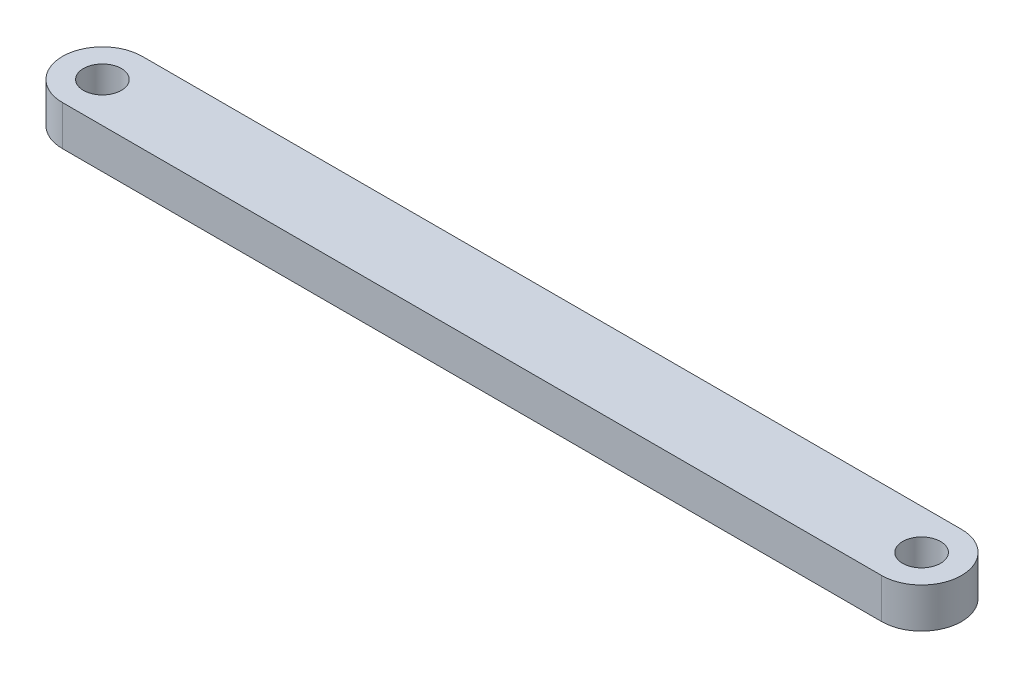
from build123d import *

# Parameters (mm, degrees)
SKETCH2_R           = 0.95
BOSS_EXTRUDE1_DEPTH = 1


with BuildPart() as part:
    # Sketch2 → Boss-Extrude1 (new, symmetric)
    with BuildSketch(Plane(origin=(0, 0, 0), x_dir=(1, 0, 0), z_dir=(0, 1, 0))):
        with BuildLine():
            Line((20.5, -2), (-20.5, -2))
            ThreePointArc((-20.5, -2), (-22.5, 0), (-20.5, 2))
            Line((-20.5, 2), (20.5, 2))
            ThreePointArc((20.5, 2), (22.5, 0), (20.5, -2))
        make_face()
        with Locations(Location((-20.5, 0, 0), (0, 0, 270))):
            Circle(SKETCH2_R, mode=Mode.SUBTRACT)
        with Locations(Location((20.5, 0, 0), (0, 0, 270))):
            Circle(SKETCH2_R, mode=Mode.SUBTRACT)
    extrude(amount=BOSS_EXTRUDE1_DEPTH, both=True)


solid = part.part
